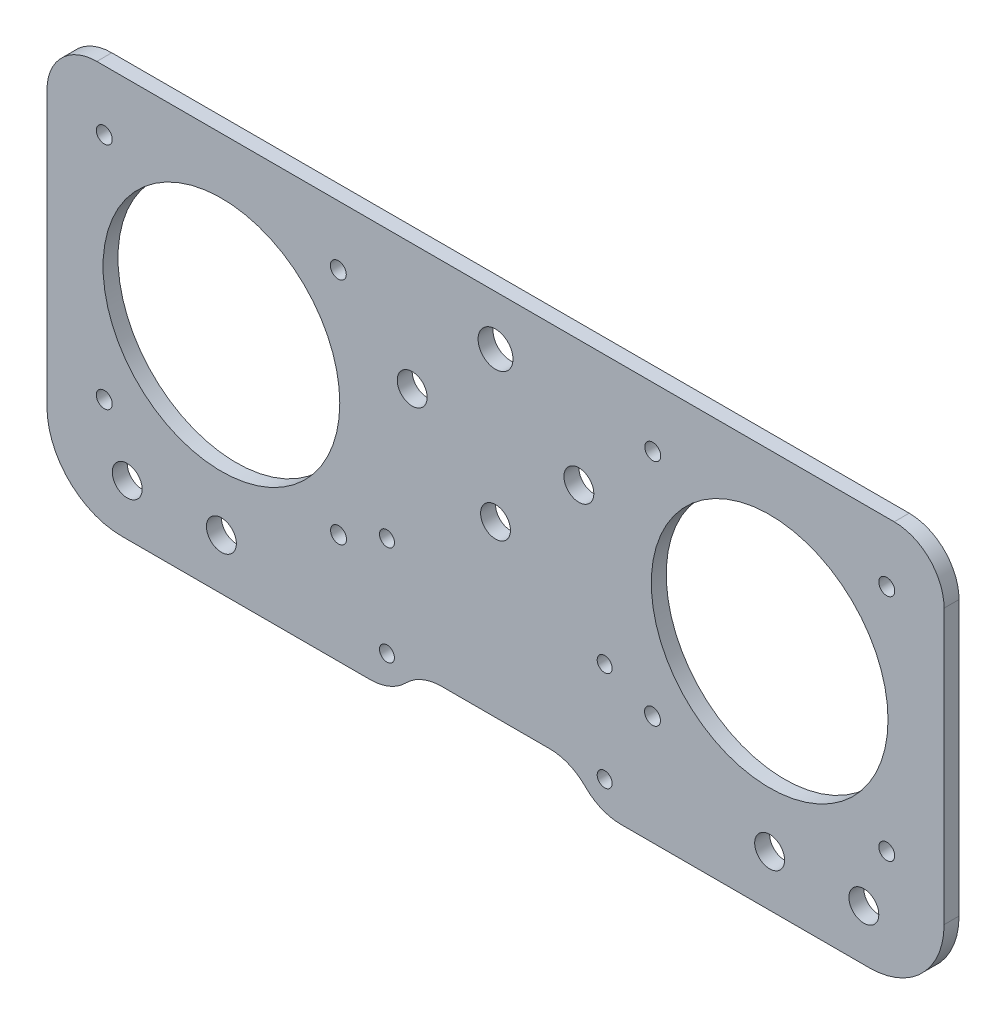
from build123d import *

# Parameters (mm, degrees)
SKETCH1_W           = 180
SKETCH1_H           = 80
SKETCH1_R           = 23.75
BOSS_EXTRUDE1_DEPTH = 3
CUT_EXTRUDE2_DEPTH  = 3
SKETCH4_R           = 1.6
CUT_EXTRUDE3_DEPTH  = 3
SKETCH7_R           = 3
SKETCH7_R_2         = 3.5
CUT_EXTRUDE4_DEPTH  = 3
FILLET1_R           = 10
FILLET2_R           = 15
FILLET3_R           = 10
SKETCH8_R           = 3
CUT_EXTRUDE6_DEPTH  = 10
SKETCH9_R           = 1.5
CUT_EXTRUDE7_DEPTH  = 10


with BuildPart() as part:
    # Sketch1 → Boss-Extrude1 (new body)
    with BuildSketch(Plane.XY):
        Rectangle(SKETCH1_W, SKETCH1_H)
        with Locations((55, 5)):
            Circle(SKETCH1_R, mode=Mode.SUBTRACT)
        with Locations((-55, 5)):
            Circle(SKETCH1_R, mode=Mode.SUBTRACT)
    extrude(amount=BOSS_EXTRUDE1_DEPTH)

    # Sketch3 → Cut-Extrude2 (cut)
    with BuildSketch(Plane.XY.offset(3)):
        Polygon((-21, -40), (-15, -34), (15, -34), (21, -40), align=None)
    extrude(amount=-CUT_EXTRUDE2_DEPTH, mode=Mode.SUBTRACT)

    # Sketch4 → Cut-Extrude3 (cut)
    with BuildSketch(Plane.XY.offset(3)):
        with Locations((-78.5, 28)):
            Circle(SKETCH4_R)
        with Locations((-31.545874822, 28)):
            Circle(SKETCH4_R)
        with Locations((-31.5, -18)):
            Circle(SKETCH4_R)
        with Locations((-78.5, -18)):
            Circle(SKETCH4_R)
        with Locations(Location((31.5, -18, 0), (0, 0, 180))):
            Circle(SKETCH4_R)
        with Locations(Location((31.545874822, 28, 0), (0, 0, 180))):
            Circle(SKETCH4_R)
        with Locations(Location((78.5, 28, 0), (0, 0, 180))):
            Circle(SKETCH4_R)
        with Locations(Location((78.5, -18, 0), (0, 0, 180))):
            Circle(SKETCH4_R)
    extrude(amount=-CUT_EXTRUDE3_DEPTH, mode=Mode.SUBTRACT)

    # Sketch7 → Cut-Extrude4 (cut)
    with BuildSketch(Plane.XY.offset(3)):
        Circle(SKETCH7_R)
        with Locations((0, 30)):
            Circle(SKETCH7_R_2)
    extrude(amount=-CUT_EXTRUDE4_DEPTH, mode=Mode.SUBTRACT)

    # Fillet1
    fillet1_edges = [part.edges().sort_by_distance(p)[0] for p in [
        (-90, 40, 1.5),
        (90, 40, 1.5),
    ]]
    fillet(fillet1_edges, radius=FILLET1_R)

    # Fillet2
    fillet2_edges = [part.edges().sort_by_distance(p)[0] for p in [
        (90, -40, 1.5),
        (-90, -40, 1.5),
    ]]
    fillet(fillet2_edges, radius=FILLET2_R)

    # Fillet3
    fillet3_edges = [part.edges().sort_by_distance(p)[0] for p in [
        (-15, -34, 1.5),
        (15, -34, 1.5),
        (21, -40, 1.5),
        (-21, -40, 1.5),
    ]]
    fillet(fillet3_edges, radius=FILLET3_R)

    # Sketch8 → Cut-Extrude6 (cut)
    with BuildSketch(Plane.XY.offset(3)):
        with Locations((-55, -29.8)):
            Circle(SKETCH8_R)
        with Locations((-73.9, -29.8)):
            Circle(SKETCH8_R)
        with Locations((55, -29.8)):
            Circle(SKETCH8_R)
        with Locations((73.9, -29.8)):
            Circle(SKETCH8_R)
        with Locations((-16.722937411, 14.75)):
            Circle(SKETCH8_R)
        with Locations((16.722937411, 14.75)):
            Circle(SKETCH8_R)
    extrude(amount=-CUT_EXTRUDE6_DEPTH, mode=Mode.SUBTRACT)

    # Sketch9 → Cut-Extrude7 (cut)
    with BuildSketch(Plane(origin=(0, 0, 0), x_dir=(-1, 0, 0), z_dir=(0, 0, -1))):
        with Locations((-21.9, -33.770050686)):
            Circle(SKETCH9_R)
        with Locations((-21.9, -13.770050686)):
            Circle(SKETCH9_R)
        with Locations(Location((21.782825633, -13.770050686, 0), (0, 0, 180))):
            Circle(SKETCH9_R)
        with Locations(Location((21.782825633, -33.770050686, 0), (0, 0, 180))):
            Circle(SKETCH9_R)
    extrude(amount=-CUT_EXTRUDE7_DEPTH, mode=Mode.SUBTRACT)


solid = part.part
